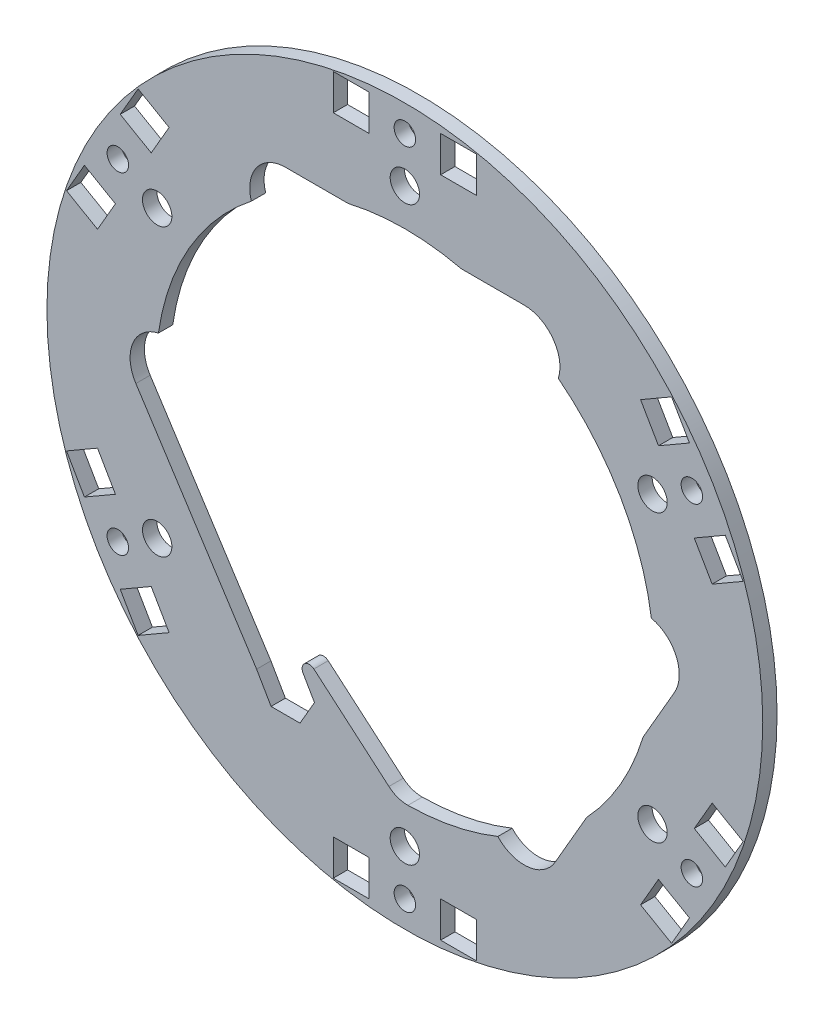
from build123d import *

# Parameters (mm, degrees)
ESQUISSE1_R        = 50
ESQUISSE1_W        = 5
ESQUISSE1_H        = 5
ESQUISSE1_R_2      = 1.5
ESQUISSE1_R_3      = 2.05
BOSS_EXTRU_1_DEPTH = 2
SKETCH3_W          = 1
SKETCH3_H          = 8
CUT_EXTRUDE2_DEPTH = 10
CUT_EXTRUDE5_DEPTH = 10
FILLET1_R          = 1
FILLET2_R          = 4


with BuildPart() as part:
    # Esquisse1 → Boss.-Extru.1 (new body)
    with BuildSketch(Plane.XY):
        Circle(ESQUISSE1_R)
        Polygon((-39.762039705, -28.730127019), (-35.431912686, -26.230127019), (-32.931912686, -30.560254038), (-37.262039705, -33.060254038), align=None, mode=Mode.SUBTRACT)
        with Locations((-7.5, -46.3)):
            Rectangle(ESQUISSE1_W, ESQUISSE1_H, mode=Mode.SUBTRACT)
        with Locations((-40.096976195, -23.15)):
            Circle(ESQUISSE1_R_2, mode=Mode.SUBTRACT)
        Polygon((-42.931912686, -13.239745962), (-40.431912686, -17.569872981), (-44.762039705, -20.069872981), (-47.262039705, -15.739745962), align=None, mode=Mode.SUBTRACT)
        with Locations((-34.597845014, -19.975075133)):
            Circle(ESQUISSE1_R_3, mode=Mode.SUBTRACT)
        with BuildLine():
            ThreePointArc((-37.576499896, -2.739399901), (-35.858643923, 4.373966246), (-28.839360147, 2.304990085))
            Line((-28.839360147, 2.304990085), (-14.645940725, -25.367513459))
            Line((-14.645940725, -25.367513459), (-12.625214782, -28.867513459))
            Line((-12.625214782, -28.867513459), (-14.645940725, -32.367513459))
            Line((-14.645940725, -32.367513459), (-18.687392609, -32.367513459))
            Line((-18.687392609, -32.367513459), (-20.708118551, -28.867513459))
            Line((-20.708118551, -28.867513459), (-37.576499896, -2.739399901))
        make_face(mode=Mode.SUBTRACT)
        with Locations((-16.671397033, -9.625235564)):
            Circle(ESQUISSE1_R_3, mode=Mode.SUBTRACT)
        with Locations((0, -46.3)):
            Circle(ESQUISSE1_R_2, mode=Mode.SUBTRACT)
        with Locations((7.5, -46.3)):
            Rectangle(ESQUISSE1_W, ESQUISSE1_H, mode=Mode.SUBTRACT)
        with Locations((0, -39.950150265)):
            Circle(ESQUISSE1_R_3, mode=Mode.SUBTRACT)
        Polygon((32.931912686, -30.560254038), (35.431912686, -26.230127019), (39.762039705, -28.730127019), (37.262039705, -33.060254038), align=None, mode=Mode.SUBTRACT)
        with Locations((0, -19.232757636)):
            Circle(ESQUISSE1_R_3, mode=Mode.SUBTRACT)
        with Locations((16.666666667, -9.622504487)):
            Circle(ESQUISSE1_R_3, mode=Mode.SUBTRACT)
        with Locations((34.597845014, -19.975075132)):
            Circle(ESQUISSE1_R_3, mode=Mode.SUBTRACT)
        with BuildLine():
            ThreePointArc((20.996793686, -31.367513459), (14.166666667, -33.197640478), (12.336539648, -26.367513459))
            Line((12.336539648, -26.367513459), (29.003206314, 2.5))
            ThreePointArc((29.003206314, 2.5), (35.833333333, 4.330127019), (37.663460352, -2.5))
            Line((37.663460352, -2.5), (20.996793686, -31.367513459))
        make_face(mode=Mode.SUBTRACT)
        with Locations((40.096976195, -23.15)):
            Circle(ESQUISSE1_R_2, mode=Mode.SUBTRACT)
        Polygon((44.762039705, -20.069872981), (40.431912686, -17.569872981), (42.931912686, -13.239745962), (47.262039705, -15.739745962), align=None, mode=Mode.SUBTRACT)
        Polygon((-44.762039705, 20.069872981), (-40.431912686, 17.569872981), (-42.931912686, 13.239745962), (-47.262039705, 15.739745962), align=None, mode=Mode.SUBTRACT)
        with Locations((-40.096976195, 23.15)):
            Circle(ESQUISSE1_R_2, mode=Mode.SUBTRACT)
        with Locations((-34.597845014, 19.975075133)):
            Circle(ESQUISSE1_R_3, mode=Mode.SUBTRACT)
        with Locations((-16.671397032, 9.625235564)):
            Circle(ESQUISSE1_R_3, mode=Mode.SUBTRACT)
        Polygon((-32.931912686, 30.560254038), (-35.431912686, 26.230127019), (-39.762039705, 28.730127019), (-37.262039705, 33.060254038), align=None, mode=Mode.SUBTRACT)
        with Locations((0, 39.950150265)):
            Circle(ESQUISSE1_R_3, mode=Mode.SUBTRACT)
        with Locations((-7.5, 46.3)):
            Rectangle(ESQUISSE1_W, ESQUISSE1_H, mode=Mode.SUBTRACT)
        Circle(ESQUISSE1_R_3, mode=Mode.SUBTRACT)
        with Locations((16.669571796, 9.624181764)):
            Circle(ESQUISSE1_R_3, mode=Mode.SUBTRACT)
        with Locations((0, 19.165334425)):
            Circle(ESQUISSE1_R_3, mode=Mode.SUBTRACT)
        with Locations((34.597845014, 19.975075133)):
            Circle(ESQUISSE1_R_3, mode=Mode.SUBTRACT)
        Polygon((42.931912686, 13.239745962), (40.431912686, 17.569872981), (44.762039705, 20.069872981), (47.262039705, 15.739745962), align=None, mode=Mode.SUBTRACT)
        with Locations((40.096976195, 23.15)):
            Circle(ESQUISSE1_R_2, mode=Mode.SUBTRACT)
        with BuildLine():
            ThreePointArc((-16.666666667, 23.867513459), (-21.666666667, 28.867513459), (-16.666666667, 33.867513459))
            Line((-16.666666667, 33.867513459), (16.666666667, 33.867513459))
            ThreePointArc((16.666666667, 33.867513459), (21.666666667, 28.867513459), (16.666666667, 23.867513459))
            Line((16.666666667, 23.867513459), (-16.666666667, 23.867513459))
        make_face(mode=Mode.SUBTRACT)
        with Locations((0, 46.3)):
            Circle(ESQUISSE1_R_2, mode=Mode.SUBTRACT)
        with Locations((7.5, 46.3)):
            Rectangle(ESQUISSE1_W, ESQUISSE1_H, mode=Mode.SUBTRACT)
        Polygon((39.762039705, 28.730127019), (35.431912686, 26.230127019), (32.931912686, 30.560254038), (37.262039705, 33.060254038), align=None, mode=Mode.SUBTRACT)
    extrude(amount=BOSS_EXTRU_1_DEPTH)

    # Sketch3 → Cut-Extrude2 (cut)
    with BuildSketch(Plane.XY.offset(2)):
        with Locations((-10.5, 0)):
            Rectangle(SKETCH3_W, SKETCH3_H)
        with Locations((-22.833333333, 0)):
            Rectangle(SKETCH3_W, SKETCH3_H)
        Polygon((-13.233653965, 23.921361037), (-14.099679369, 23.421361037), (-12.349679369, 20.390272124), (-15.380768282, 18.640272124), (-14.880768282, 17.77424672), (-11.849679369, 19.52424672), (-10.099679369, 16.493157806), (-9.233653965, 16.993157806), (-10.983653965, 20.02424672), (-7.952565052, 21.77424672), (-8.452565052, 22.640272124), (-11.483653965, 20.890272124), align=None)
        Polygon((15.130768282, 18.207259422), (14.630768282, 17.341234018), (7.702565052, 21.341234018), (8.202565052, 22.207259422), align=None)
        Polygon((8.202565052, -22.207259422), (7.702565052, -21.341234018), (14.630768282, -17.341234018), (15.130768282, -18.207259422), align=None)
        Polygon((27.333333333, -0.5), (27.333333333, 0.5), (23.833333333, 0.5), (23.833333333, 4), (22.833333333, 4), (22.833333333, 0.5), (19.333333333, 0.5), (19.333333333, -0.5), (22.833333333, -0.5), (22.833333333, -4), (23.833333333, -4), (23.833333333, -0.5), align=None)
        Polygon((-14.099679369, -23.421361037), (-13.233653965, -23.921361037), (-11.483653965, -20.890272124), (-8.452565052, -22.640272124), (-7.952565052, -21.77424672), (-10.983653965, -20.02424672), (-9.233653965, -16.993157806), (-10.099679369, -16.493157806), (-11.849679369, -19.52424672), (-14.880768282, -17.77424672), (-15.380768282, -18.640272124), (-12.349679369, -20.390272124), align=None)
        Polygon((-20.834234776, 12.184801987), (-19.940304487, 11.668776346), (-20.102964744, 11.386925384), (-20.996895032, 11.902951025), (-21.517828526, 11.000607275), (-21.800380609, 11.163968654), (-21.279447115, 12.066312404), (-22.173377404, 12.582338045), (-22.010717147, 12.864189006), (-21.116786859, 12.348163365), (-20.596554487, 13.24840375), (-20.314002404, 13.085042371), align=None)
    extrude(amount=-CUT_EXTRUDE2_DEPTH, mode=Mode.SUBTRACT)

    # Sketch5 → Cut-Extrude5 (cut)
    with BuildSketch(Plane.XY.offset(2)):
        with BuildLine():
            Line((-16.642935498, -21.474029915), (-1.119551078, -34.759587589))
            ThreePointArc((-1.119551078, -34.759587589), (26.640402268, 22.355565101), (-34.426269912, 4.930949597))
            Line((-34.426269912, 4.930949597), (-16.642935498, -21.474029915))
        make_face()
    extrude(amount=-CUT_EXTRUDE5_DEPTH, mode=Mode.SUBTRACT)

    # Fillet1
    fillet1_edges = [part.edges().sort_by_distance(p)[0] for p in [
        (-16.642935498, -21.474029915, 1),
    ]]
    fillet(fillet1_edges, radius=FILLET1_R)

    # Fillet2
    fillet2_edges = [part.edges().sort_by_distance(p)[0] for p in [
        (-1.119551078, -34.759587589, 1),
    ]]
    fillet(fillet2_edges, radius=FILLET2_R)


solid = part.part
